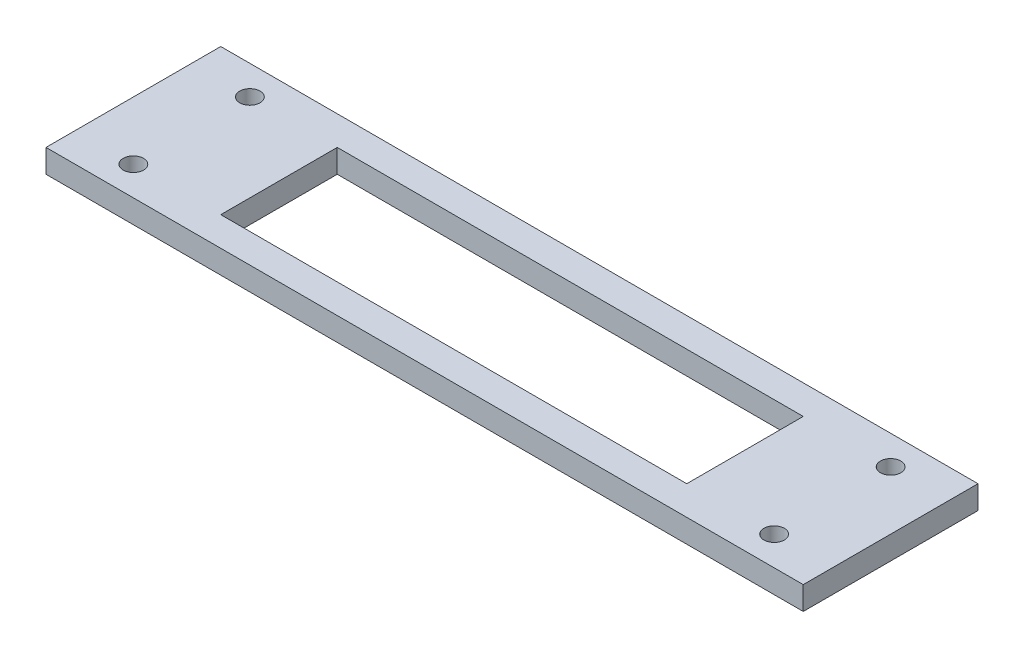
from build123d import *

# Parameters (mm, degrees)
SKETCH1_W           = 130
SKETCH1_H           = 30
SKETCH1_R           = 1.75
BOSS_EXTRUDE1_DEPTH = 4
SKETCH2_W           = 80
SKETCH2_H           = 20
CUT_EXTRUDE1_DEPTH  = 134.476589708


with BuildPart() as part:
    # Sketch1 → Boss-Extrude1 (new body)
    with BuildSketch(Plane(origin=(0, 0, 0), x_dir=(1, 0, 0), z_dir=(0, 1, 0))):
        with Locations((65, 15)):
            Rectangle(SKETCH1_W, SKETCH1_H)
        with Locations(Location((120, 25, 0), (0, 0, 270))):
            Circle(SKETCH1_R, mode=Mode.SUBTRACT)
        with Locations(Location((120, 5, 0), (0, 0, 270))):
            Circle(SKETCH1_R, mode=Mode.SUBTRACT)
        with Locations(Location((10, 5, 0), (0, 0, 270))):
            Circle(SKETCH1_R, mode=Mode.SUBTRACT)
        with Locations(Location((10, 25, 0), (0, 0, 270))):
            Circle(SKETCH1_R, mode=Mode.SUBTRACT)
    extrude(amount=BOSS_EXTRUDE1_DEPTH)

    # Sketch2 → Cut-Extrude1 (cut, through all)
    with BuildSketch(Plane(origin=(0, 4, 0), x_dir=(1, 0, 0), z_dir=(0, 1, 0))):
        with Locations((65, 15)):
            Rectangle(SKETCH2_W, SKETCH2_H)
    extrude(amount=-CUT_EXTRUDE1_DEPTH, mode=Mode.SUBTRACT)


solid = part.part
